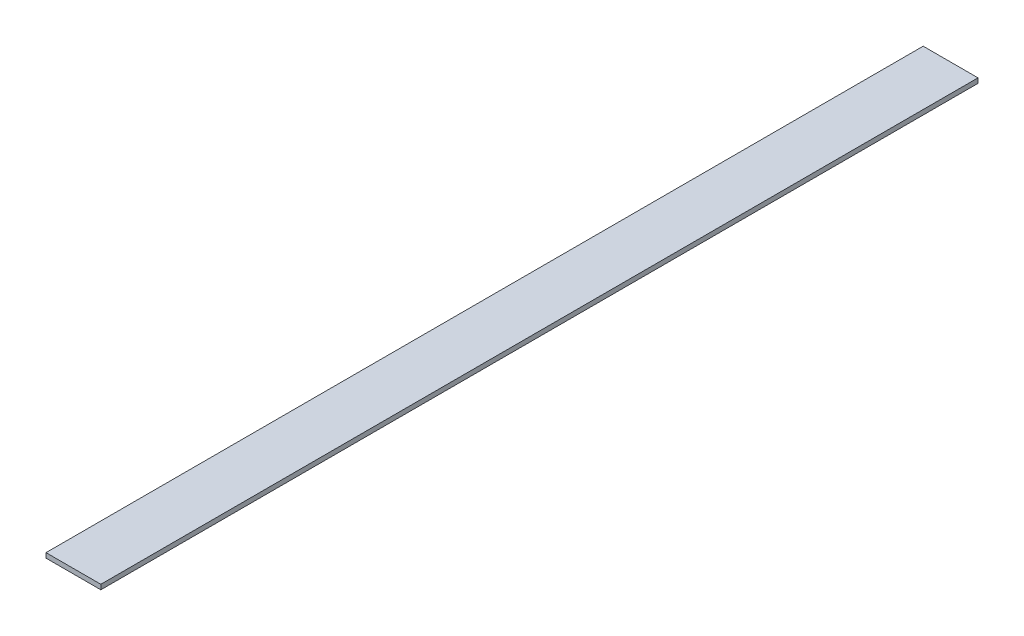
from build123d import *

# Parameters (mm, degrees)
OUTLINE_W           = 57.15
OUTLINE_H           = 914.4
BOSS_EXTRUDE1_DEPTH = 5


with BuildPart() as part:
    # Outline → Boss-Extrude1 (new body)
    with BuildSketch(Plane(origin=(0, 0, 0), x_dir=(1, 0, 0), z_dir=(0, 1, 0))):
        with Locations((28.575, -457.2)):
            Rectangle(OUTLINE_W, OUTLINE_H)
    extrude(amount=BOSS_EXTRUDE1_DEPTH)


solid = part.part
